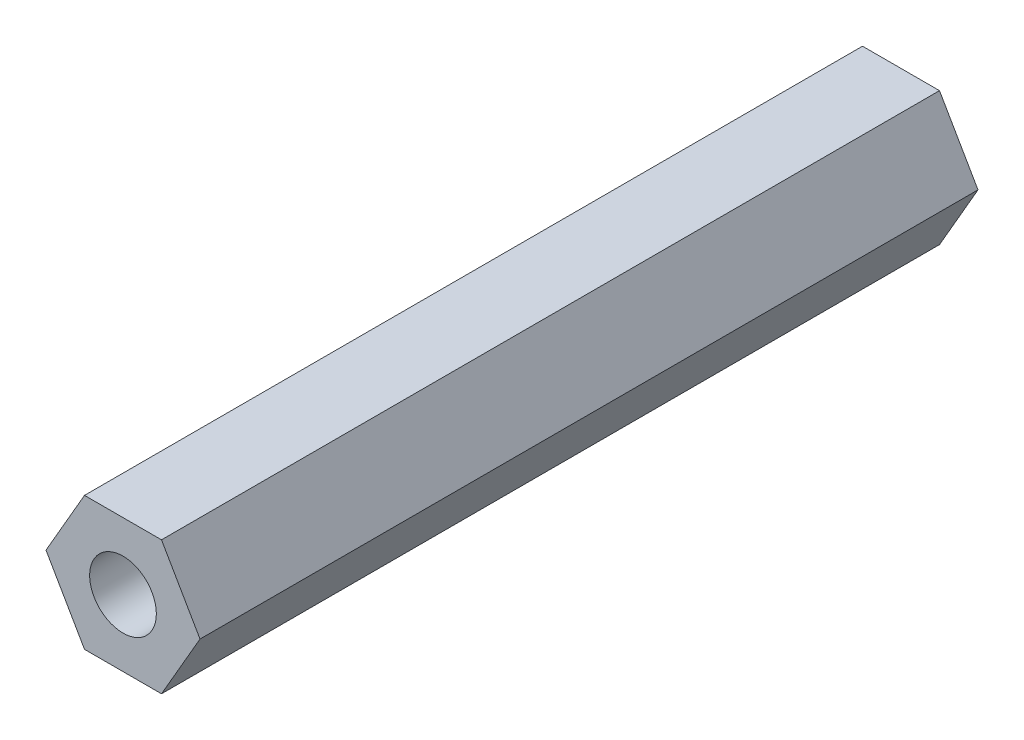
from build123d import *

# Parameters (mm, degrees)
EXTRUDE_1_DEPTH     = 35
SKETCH_2_R          = 1.5
CUT_EXTRUDE_1_DEPTH = 36.88871689


with BuildPart() as part:
    # 草图1 → 凸台-拉伸1 (new body)
    with BuildSketch(Plane.XY):
        Polygon((0, 0), (3.464101615, 0), (5.196152423, -3), (3.464101615, -6), (0, -6), (-1.732050808, -3), align=None)
    extrude(amount=EXTRUDE_1_DEPTH)

    # 草图2 → 切除-拉伸1 (cut, through all)
    with BuildSketch(Plane.XY.offset(35)):
        with Locations((1.732050808, -3)):
            Circle(SKETCH_2_R)
    extrude(amount=-CUT_EXTRUDE_1_DEPTH, mode=Mode.SUBTRACT)


solid = part.part
